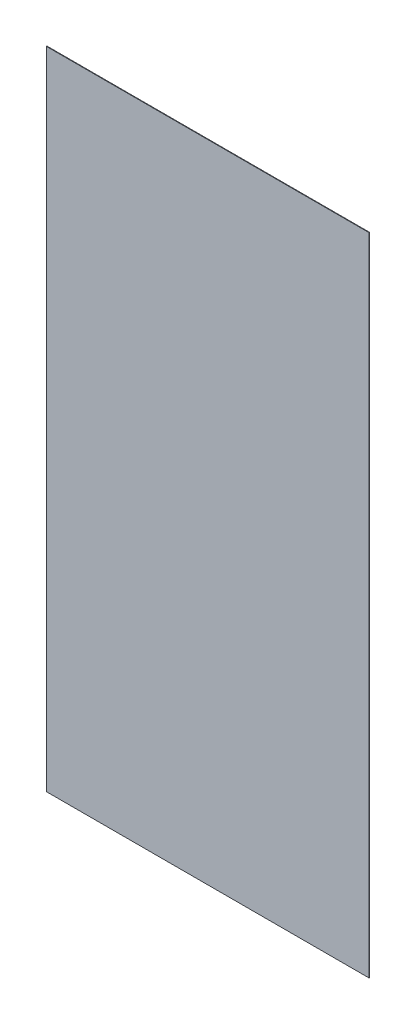
from build123d import *

# Parameters (mm, degrees)
SKETCH1_W           = 914.4
SKETCH1_H           = 1828.8
BOSS_EXTRUDE1_DEPTH = 1.5875


with BuildPart() as part:
    # Sketch1 → Boss-Extrude1 (new body)
    with BuildSketch(Plane.XY):
        with Locations((457.2, 914.4)):
            Rectangle(SKETCH1_W, SKETCH1_H)
    extrude(amount=BOSS_EXTRUDE1_DEPTH)


solid = part.part
